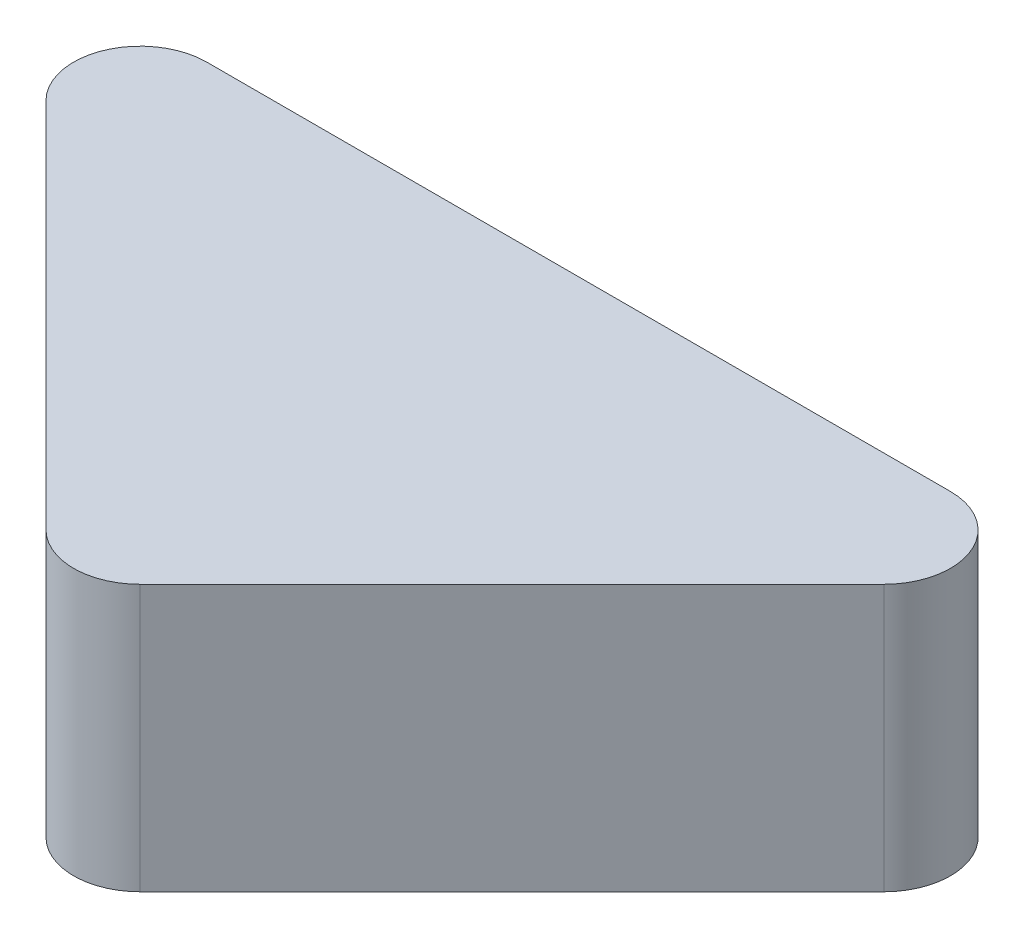
from build123d import *

# Parameters (mm, degrees)
BOSS_EXTRUDE1_DEPTH = 25.4
FILLET1_R           = 6.35


with BuildPart() as part:
    # Sketch1 → Boss-Extrude1 (new body)
    with BuildSketch(Plane(origin=(0, 0, 0), x_dir=(1, 0, 0), z_dir=(0, 1, 0))):
        Polygon((0, 0), (50.8, 50.8), (-50.8, 50.8), align=None)
    extrude(amount=BOSS_EXTRUDE1_DEPTH)

    # Fillet1
    fillet1_edges = [part.edges().sort_by_distance(p)[0] for p in [
        (-50.8, 12.7, -50.8),
        (50.8, 12.7, -50.8),
        (0, 12.7, 0),
    ]]
    fillet(fillet1_edges, radius=FILLET1_R)


solid = part.part
